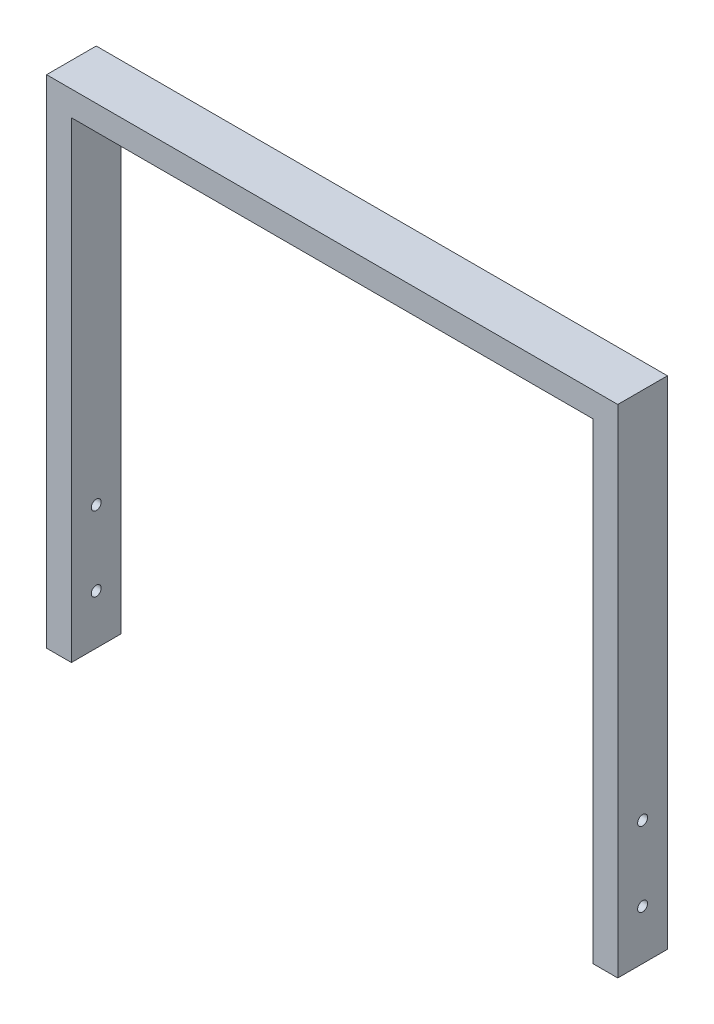
from build123d import *

# Parameters (mm, degrees)
BOSS_EXTRUDE1_DEPTH = 10
SKETCH2_R           = 2
CUT_EXTRUDE1_DEPTH  = 305.95901364


with BuildPart() as part:
    # Sketch1 → Boss-Extrude1 (new, symmetric)
    with BuildSketch(Plane.XY):
        Polygon((0, 0), (0, 200), (230, 200), (230, 0), (220, 0), (220, 190), (10, 190), (10, 0), align=None)
    extrude(amount=BOSS_EXTRUDE1_DEPTH, both=True)

    # Sketch2 → Cut-Extrude1 (cut, through all)
    with BuildSketch(Plane.ZY):
        with Locations((0, 20)):
            Circle(SKETCH2_R)
        with Locations((0, 50)):
            Circle(SKETCH2_R)
    extrude(amount=-CUT_EXTRUDE1_DEPTH, mode=Mode.SUBTRACT)


solid = part.part
